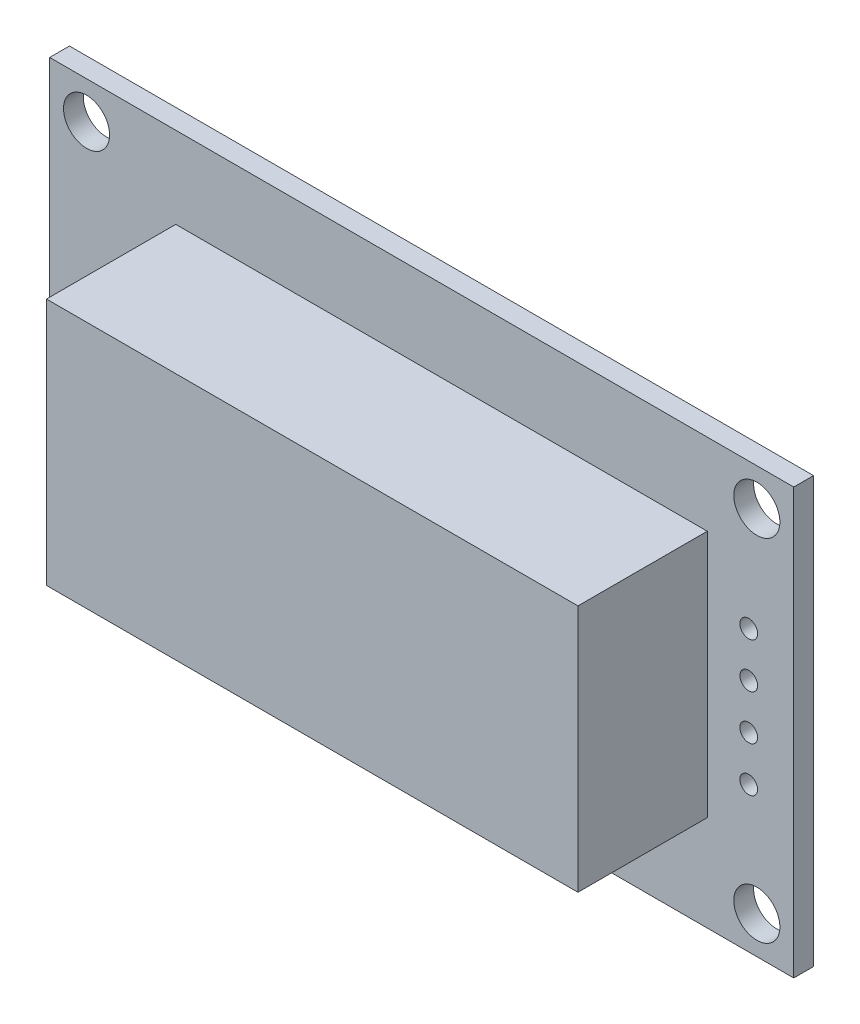
from build123d import *

# Parameters (mm, degrees)
SKETCH1_W           = 42
SKETCH1_H           = 24
BOSS_EXTRUDE1_DEPTH = 1.1176
SKETCH2_R           = 1.3
CUT_EXTRUDE1_DEPTH  = 25.21257999
SKETCH3_W           = 30
SKETCH3_H           = 14
BOSS_EXTRUDE2_DEPTH = 7.3
SKETCH4_R           = 0.5
CUT_EXTRUDE2_DEPTH  = 26.609685468
SKETCH5_W           = 9
SKETCH5_H           = 12.25
BOSS_EXTRUDE3_DEPTH = 2.5
SKETCH6_W           = 3.16
SKETCH6_H           = 1.2
BOSS_EXTRUDE4_DEPTH = 1.2


with BuildPart() as part:
    # Sketch1 → Boss-Extrude1 (new body)
    with BuildSketch(Plane.XY):
        Rectangle(SKETCH1_W, SKETCH1_H)
    extrude(amount=BOSS_EXTRUDE1_DEPTH)

    # Sketch2 → Cut-Extrude1 (cut, through all)
    with BuildSketch(Plane.XY):
        with Locations((-18.9175, 9.8975)):
            Circle(SKETCH2_R)
        with Locations((-18.9175, -9.8975)):
            Circle(SKETCH2_R)
        with Locations((18.9175, -9.8975)):
            Circle(SKETCH2_R)
        with Locations((18.9175, 9.8975)):
            Circle(SKETCH2_R)
    extrude(amount=CUT_EXTRUDE1_DEPTH, mode=Mode.SUBTRACT)

    # Sketch3 → Boss-Extrude2 (add)
    with BuildSketch(Plane.XY.offset(1.1176)):
        with Locations((1.12, 0.4)):
            Rectangle(SKETCH3_W, SKETCH3_H)
    extrude(amount=BOSS_EXTRUDE2_DEPTH)

    # Sketch4 → Cut-Extrude2 (cut, through all)
    with BuildSketch(Plane.XY):
        with Locations((18.46, 3.81)):
            Circle(SKETCH4_R)
        with Locations((18.46, 1.27)):
            Circle(SKETCH4_R)
        with Locations((18.46, -1.27)):
            Circle(SKETCH4_R)
        with Locations((18.46, -3.81)):
            Circle(SKETCH4_R)
    extrude(amount=CUT_EXTRUDE2_DEPTH, mode=Mode.SUBTRACT)

    # Sketch5 → Boss-Extrude3 (add)
    with BuildSketch(Plane(origin=(0, 0, 0), x_dir=(-1, 0, 0), z_dir=(0, 0, -1))):
        with Locations((13.14, -0.225)):
            Rectangle(SKETCH5_W, SKETCH5_H)
    extrude(amount=BOSS_EXTRUDE3_DEPTH)

    # Sketch6 → Boss-Extrude4 (add)
    with BuildSketch(Plane(origin=(0, 0, 0), x_dir=(-1, 0, 0), z_dir=(0, 0, -1))):
        with Locations((15.42, 8.8092)):
            Rectangle(SKETCH6_W, SKETCH6_H)
    extrude(amount=BOSS_EXTRUDE4_DEPTH)


solid = part.part
